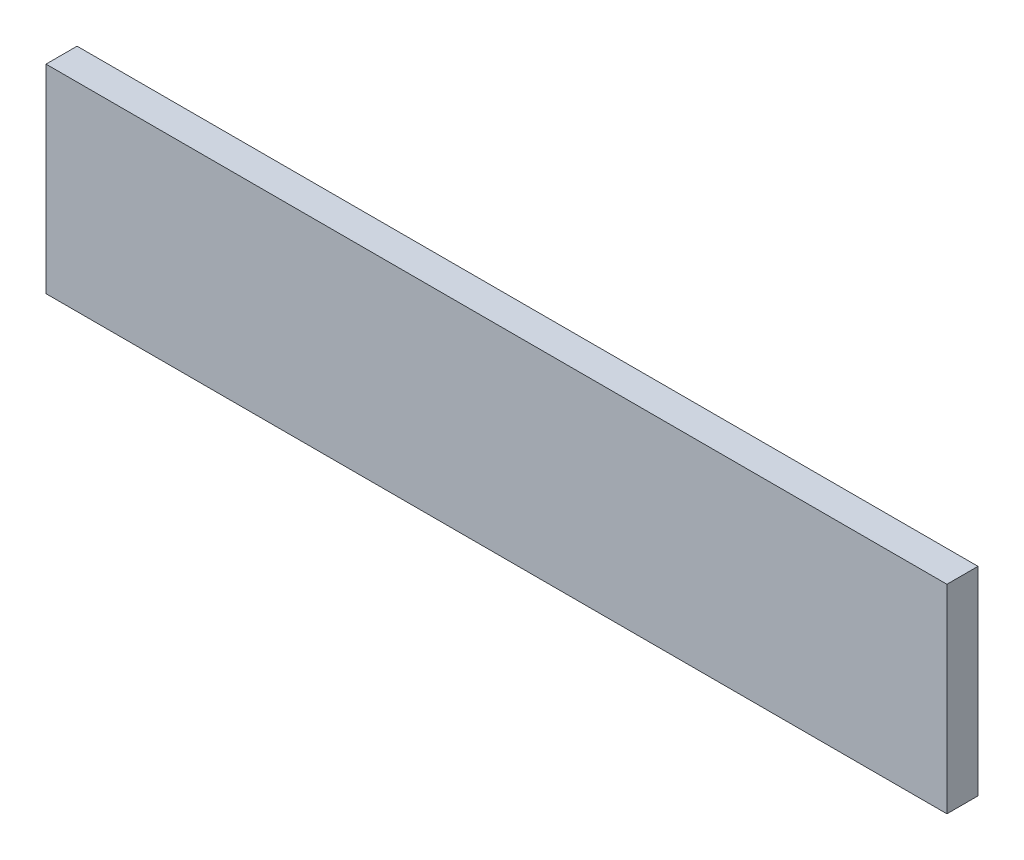
from build123d import *

# Parameters (mm, degrees)
SKETCH2_W           = 290
SKETCH2_H           = 64
BOSS_EXTRUDE1_DEPTH = 10


with BuildPart() as part:
    # Sketch2 → Boss-Extrude1 (new body)
    with BuildSketch(Plane(origin=(0, 0, -254.663888462), x_dir=(-1, 0, 0), z_dir=(0, 0, -1))):
        with Locations((33.704435936, 8.605112082)):
            Rectangle(SKETCH2_W, SKETCH2_H)
    extrude(amount=BOSS_EXTRUDE1_DEPTH)


solid = part.part
